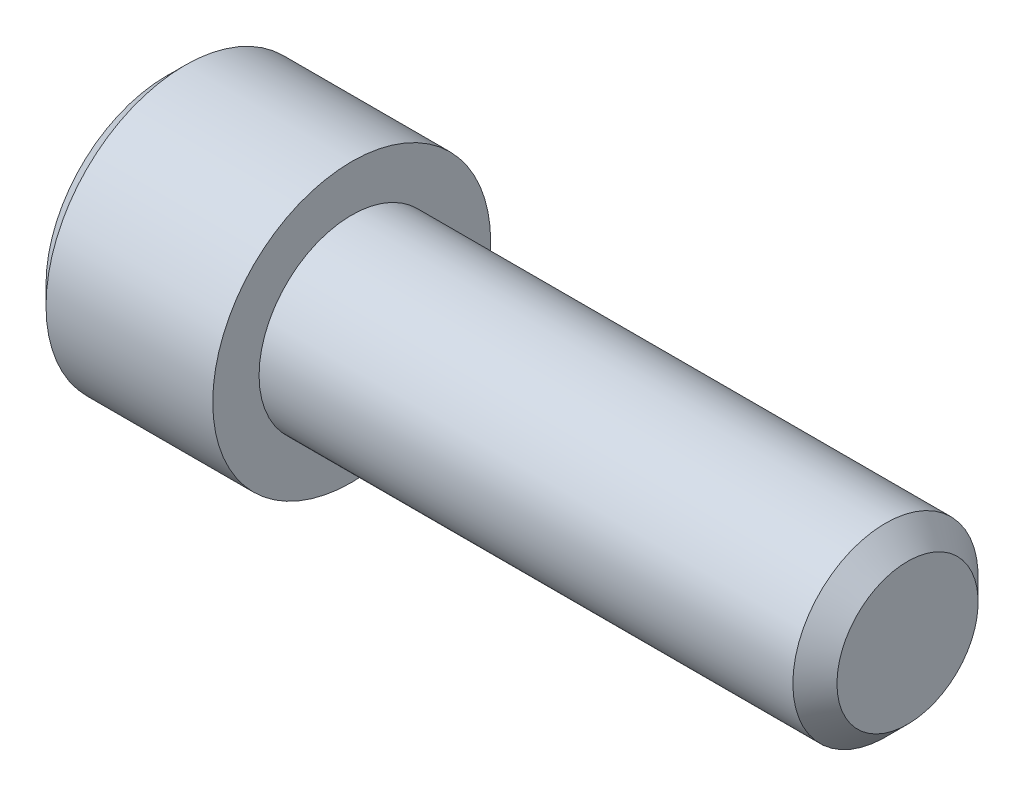
from build123d import *

# Parameters (mm, degrees)
HEX_2_DEPTH = 3.048


with BuildPart() as part:
    # BodySke → Base-Revolve (revolve)
    with BuildSketch(Plane.XY, mode=Mode.PRIVATE) as base_revolve_sk:
        Polygon((0, 0), (0, 4.1275), (0.635, 4.7625), (6.35, 4.7625), (6.35, 3.175), (24.64435, 3.175), (25.4, 2.41935), (25.4, 0), align=None)
    revolve(base_revolve_sk.sketch.rotate(Axis((-31.75, 0, 0), (1, 0, 0)), 90), axis=Axis((-31.75, 0, 0), (1, 0, 0)))

    # Sketch3 → Hex 2 (cut)
    with BuildSketch(Plane(origin=(0, 0, 0), x_dir=(0, 0.500000000000001, 0.866025403784438), z_dir=(-1, 0, 0))):
        Polygon((1.374815329, 2.38125), (-1.374815329, 2.38125), (-2.749630657, 0), (-1.374815329, -2.38125), (1.374815329, -2.38125), (2.749630657, 0), align=None)
    extrude(amount=-HEX_2_DEPTH, mode=Mode.SUBTRACT)


solid = part.part
